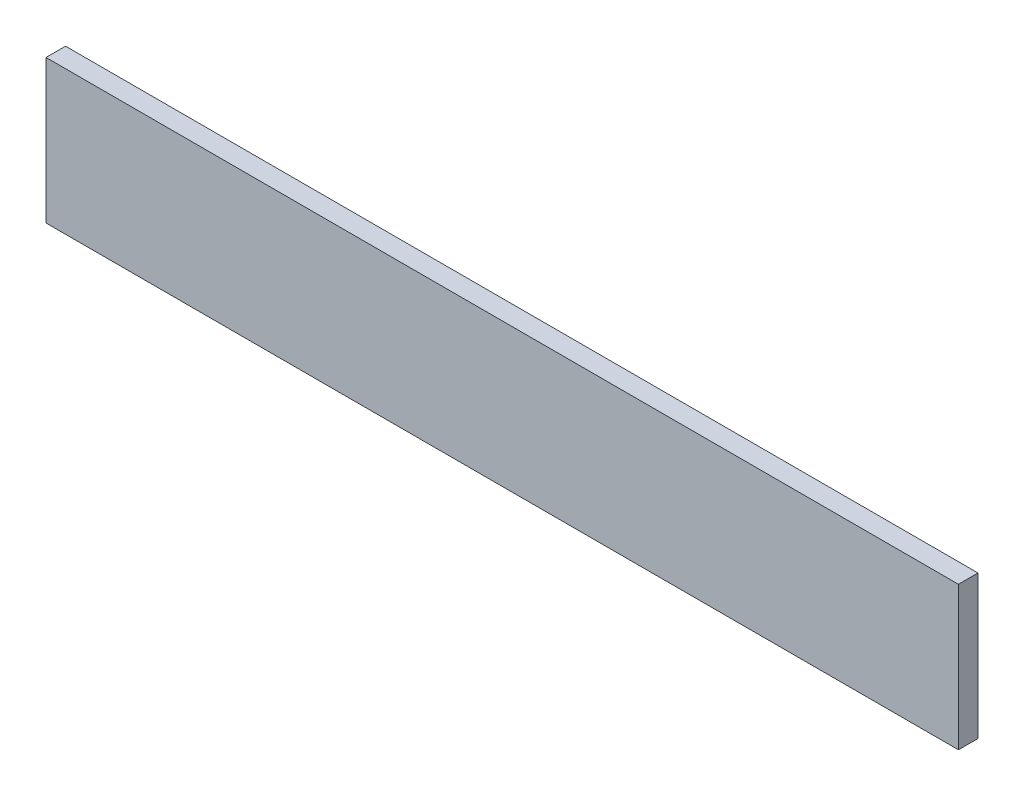
from build123d import *

# Parameters (mm, degrees)
SKETCH1_W           = 889
SKETCH1_H           = 139.7
BOSS_EXTRUDE1_DEPTH = 19.05


with BuildPart() as part:
    # Sketch1 → Boss-Extrude1 (new body)
    with BuildSketch(Plane.XY):
        with Locations((444.5, 69.85)):
            Rectangle(SKETCH1_W, SKETCH1_H)
    extrude(amount=BOSS_EXTRUDE1_DEPTH)


solid = part.part
